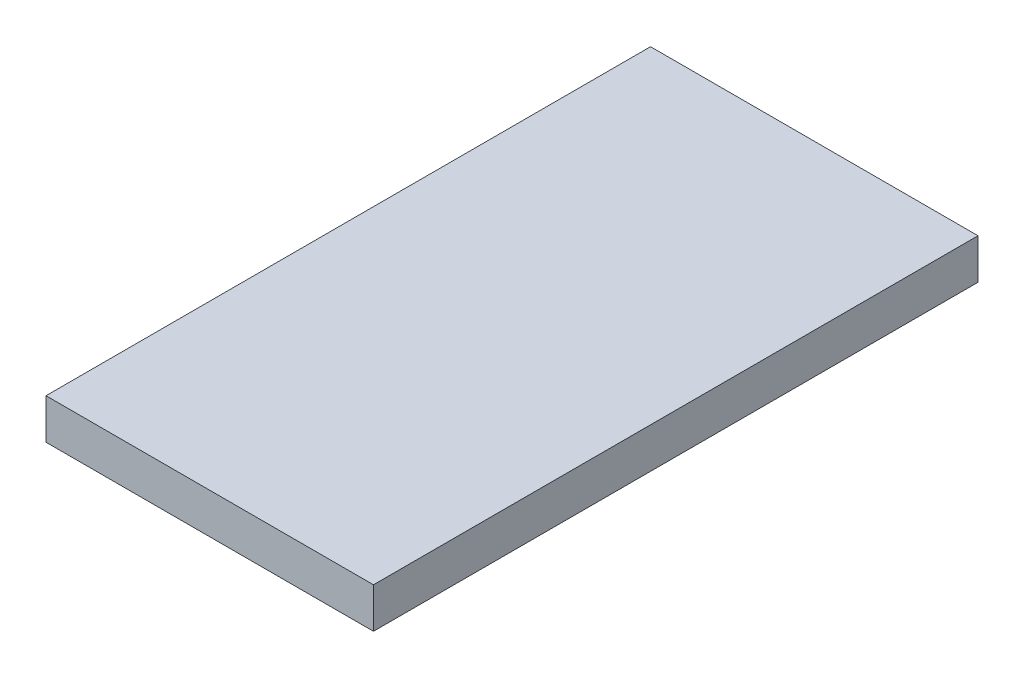
from build123d import *

# Parameters (mm, degrees)
SKETCH1_W           = 82.55
SKETCH1_H           = 152.4
BOSS_EXTRUDE1_DEPTH = 10.16


with BuildPart() as part:
    # Sketch1 → Boss-Extrude1 (new body)
    with BuildSketch(Plane(origin=(0, 0, 0), x_dir=(1, 0, 0), z_dir=(0, 1, 0))):
        Rectangle(SKETCH1_W, SKETCH1_H)
    extrude(amount=BOSS_EXTRUDE1_DEPTH)


solid = part.part
